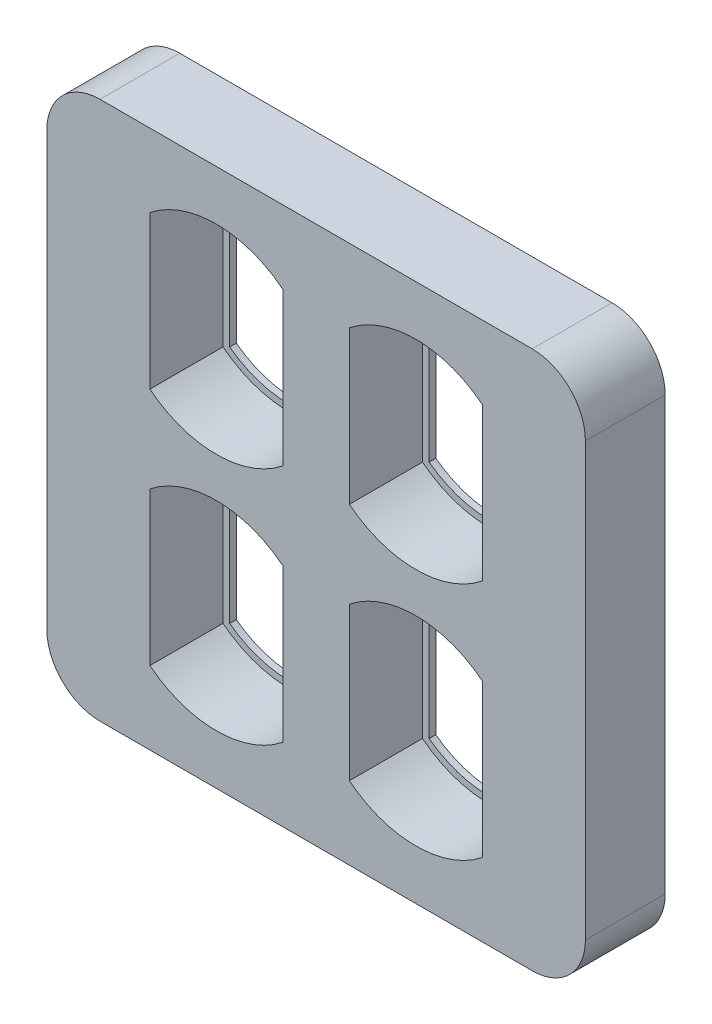
from build123d import *

# Parameters (mm, degrees)
SKETCH1_W            = 81
SKETCH1_H            = 81
BOSS_EXTRUDE1_DEPTH  = 12
CUT_EXTRUDE1_DEPTH   = 11
CUT_EXTRUDE2_DEPTH   = 59.322379924
MIRROR3_COPY_1_DEPTH = 11
MIRROR3_COPY_2_DEPTH = 59.322379924
FILLET1_R            = 8


with BuildPart() as part:
    # Sketch1 → Boss-Extrude1 (new body)
    with BuildSketch(Plane.XY):
        Rectangle(SKETCH1_W, SKETCH1_H)
    extrude(amount=BOSS_EXTRUDE1_DEPTH)

    # Sketch2 → Cut-Extrude1 (cut)
    with BuildSketch(Plane.XY.offset(12)):
        with BuildLine():
            Line((-25, 6.5), (-25, 29.5))
            ThreePointArc((-25, 29.5), (-15, 33), (-5, 29.5))
            Line((-5, 29.5), (-5, 6.5))
            ThreePointArc((-5, 6.5), (-15, 3), (-25, 6.5))
        make_face()
    cut_extrude1 = extrude(amount=-CUT_EXTRUDE1_DEPTH, mode=Mode.SUBTRACT)

    # Sketch4 → Cut-Extrude2 (cut, through all)
    with BuildSketch(Plane.XY.offset(1)):
        with BuildLine():
            Line((-6, 6.991101213), (-6, 29.008898787))
            ThreePointArc((-6, 29.008898787), (-15, 32), (-24, 29.008898787))
            Line((-24, 29.008898787), (-24, 6.991101213))
            ThreePointArc((-24, 6.991101213), (-15, 4), (-6, 6.991101213))
        make_face()
    cut_extrude2 = extrude(amount=-CUT_EXTRUDE2_DEPTH, mode=Mode.SUBTRACT)

    # Mirror2: Cut-Extrude1, Cut-Extrude2 across plane
    add(cut_extrude1.mirror(Plane.ZX), mode=Mode.SUBTRACT)
    add(cut_extrude2.mirror(Plane.ZX), mode=Mode.SUBTRACT)

    # Mirror3: Cut-Extrude1, Cut-Extrude2 across plane
    add(cut_extrude1.mirror(Plane(origin=(0, 0, 0), x_dir=(0, 0, 1), z_dir=(1, 0, 0))), mode=Mode.SUBTRACT)
    add(cut_extrude2.mirror(Plane(origin=(0, 0, 0), x_dir=(0, 0, 1), z_dir=(1, 0, 0))), mode=Mode.SUBTRACT)

    # Mirror3 copy 1 sketch → Mirror3 copy 1 (cut)
    with BuildSketch(Plane(origin=(0, 0, 12), x_dir=(-1, 0, 0), z_dir=(0, 0, 1))):
        with BuildLine():
            Line((-25, 6.5), (-25, 29.5))
            ThreePointArc((-25, 29.5), (-15, 33), (-5, 29.5))
            Line((-5, 29.5), (-5, 6.5))
            ThreePointArc((-5, 6.5), (-15, 3), (-25, 6.5))
        make_face()
    extrude(amount=-MIRROR3_COPY_1_DEPTH, mode=Mode.SUBTRACT)

    # Mirror3 copy 2 sketch → Mirror3 copy 2 (cut, through all)
    with BuildSketch(Plane(origin=(0, 0, 1), x_dir=(-1, 0, 0), z_dir=(0, 0, 1))):
        with BuildLine():
            Line((-6, 6.991101213), (-6, 29.008898787))
            ThreePointArc((-6, 29.008898787), (-15, 32), (-24, 29.008898787))
            Line((-24, 29.008898787), (-24, 6.991101213))
            ThreePointArc((-24, 6.991101213), (-15, 4), (-6, 6.991101213))
        make_face()
    extrude(amount=-MIRROR3_COPY_2_DEPTH, mode=Mode.SUBTRACT)

    # Fillet1
    fillet1_edges = [part.edges().sort_by_distance(p)[0] for p in [
        (40.5, -40.5, 6),
        (-40.5, -40.5, 6),
        (-40.5, 40.5, 6),
        (40.5, 40.5, 6),
    ]]
    fillet(fillet1_edges, radius=FILLET1_R)


solid = part.part
